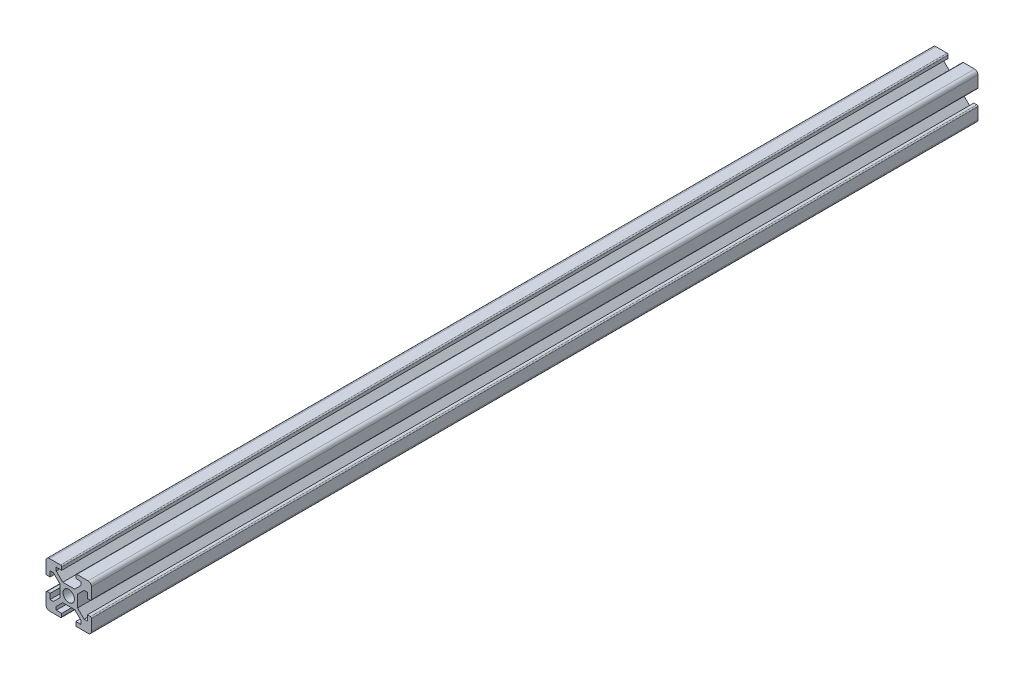
from build123d import *

# Parameters (mm, degrees)
SKETCH_1_R      = 2.5
EXTRUDE_1_DEPTH = 390
FILLET_1_R      = 1.5
FILLET_2_R      = 1.5
FILLET_3_R      = 1.5
FILLET_4_R      = 1.5
FILLET_5_R      = 0.5
FILLET_6_R      = 0.5
FILLET_7_R      = 0.5
FILLET_8_R      = 0.5
FILLET_9_R      = 0.5
FILLET_10_R     = 0.5
FILLET_11_R     = 0.5
FILLET_12_R     = 0.5


with BuildPart() as part:
    # 草图1 → 凸台-拉伸1 (new body)
    with BuildSketch(Plane.XY):
        Polygon((0, 6.9), (0, 0), (6.9, 0), (6.9, 1.8), (4.5, 1.8), (4.5, 3.227207794), (7.372792206, 6.1), (12.627207794, 6.1), (15.5, 3.227207794), (15.5, 1.8), (13.1, 1.8), (13.1, 0), (20, 0), (20, 6.9), (18.2, 6.9), (18.2, 4.5), (16.772792206, 4.5), (13.9, 7.372792206), (13.9, 12.627207794), (16.772792206, 15.5), (18.2, 15.5), (18.2, 13.1), (20, 13.1), (20, 20), (13.1, 20), (13.1, 18.2), (15.5, 18.2), (15.5, 16.772792206), (12.627207794, 13.9), (7.372792206, 13.9), (4.5, 16.772792206), (4.5, 18.2), (6.9, 18.2), (6.9, 20), (0, 20), (0, 13.1), (1.8, 13.1), (1.8, 15.5), (3.227207794, 15.5), (6.1, 12.627207794), (6.1, 7.372792206), (3.227207794, 4.5), (1.8, 4.5), (1.8, 6.9), align=None)
        with Locations((10, 10)):
            Circle(SKETCH_1_R, mode=Mode.SUBTRACT)
    extrude(amount=EXTRUDE_1_DEPTH)

    # 圆角1
    fillet_1_edges = [part.edges().sort_by_distance(p)[0] for p in [
        (20, 20, 195),
    ]]
    fillet(fillet_1_edges, radius=FILLET_1_R)

    # 圆角2
    fillet_2_edges = [part.edges().sort_by_distance(p)[0] for p in [
        (0, 20, 195),
    ]]
    fillet(fillet_2_edges, radius=FILLET_2_R)

    # 圆角3
    fillet_3_edges = [part.edges().sort_by_distance(p)[0] for p in [
        (0, 0, 195),
    ]]
    fillet(fillet_3_edges, radius=FILLET_3_R)

    # 圆角4
    fillet_4_edges = [part.edges().sort_by_distance(p)[0] for p in [
        (20, 0, 195),
    ]]
    fillet(fillet_4_edges, radius=FILLET_4_R)

    # 圆角5
    fillet_5_edges = [part.edges().sort_by_distance(p)[0] for p in [
        (13.1, 20, 195),
    ]]
    fillet(fillet_5_edges, radius=FILLET_5_R)

    # 圆角6
    fillet_6_edges = [part.edges().sort_by_distance(p)[0] for p in [
        (6.9, 20, 195),
    ]]
    fillet(fillet_6_edges, radius=FILLET_6_R)

    # 圆角7
    fillet_7_edges = [part.edges().sort_by_distance(p)[0] for p in [
        (0, 13.1, 195),
    ]]
    fillet(fillet_7_edges, radius=FILLET_7_R)

    # 圆角8
    fillet_8_edges = [part.edges().sort_by_distance(p)[0] for p in [
        (0, 6.9, 195),
    ]]
    fillet(fillet_8_edges, radius=FILLET_8_R)

    # 圆角9
    fillet_9_edges = [part.edges().sort_by_distance(p)[0] for p in [
        (6.9, 0, 195),
    ]]
    fillet(fillet_9_edges, radius=FILLET_9_R)

    # 圆角10
    fillet_10_edges = [part.edges().sort_by_distance(p)[0] for p in [
        (13.1, 0, 195),
    ]]
    fillet(fillet_10_edges, radius=FILLET_10_R)

    # 圆角11
    fillet_11_edges = [part.edges().sort_by_distance(p)[0] for p in [
        (20, 13.1, 195),
    ]]
    fillet(fillet_11_edges, radius=FILLET_11_R)

    # 圆角12
    fillet_12_edges = [part.edges().sort_by_distance(p)[0] for p in [
        (20, 6.9, 195),
    ]]
    fillet(fillet_12_edges, radius=FILLET_12_R)


solid = part.part
